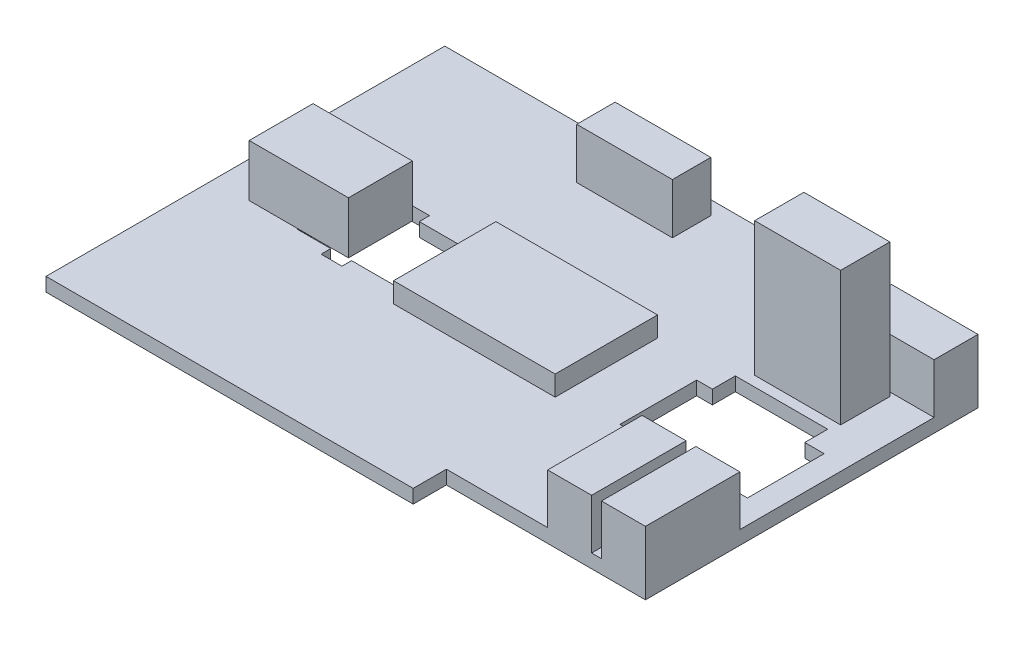
from build123d import *

# Parameters (mm, degrees)
BOSS_EXTRUDE1_DEPTH  = 1.72
CUT_EXTRUDE1_DEPTH   = 1.72
SKETCH6_W            = 5.52
SKETCH6_H            = 11.86
SKETCH6_W_2          = 10.85
SKETCH6_H_2          = 5.52
SWITCHES_DEPTH       = 6.28
SKETCH7_W            = 10.8
SKETCH7_H            = 6.18
SCROLLWHEEL_DEPTH    = 16.82
SKETCH8_W            = 20.3
SKETCH8_H            = 12.86
CHIP_DEPTH           = 2.52
SKETCH9_W            = 12.02
SKETCH9_H            = 4.82
USB_CONNECTION_DEPTH = 6.34
SKETCH10_W           = 12.47
SKETCH10_H           = 8.02
LASER_DEPTH          = 6.54


with BuildPart() as part:
    # Sketch1 → Boss-Extrude1 (new body)
    with BuildSketch(Plane(origin=(0, 0, 0), x_dir=(1, 0, 0), z_dir=(0, 1, 0))):
        Polygon((46.12, 45.94), (71.12, 45.94), (71.12, 4.17), (46.12, 4.17), (46.12, 0), (0, 0), (0, 50.09), (46.12, 50.09), align=None)
    extrude(amount=-BOSS_EXTRUDE1_DEPTH)

    # Sketch2 → Cut-Extrude1 (cut)
    with BuildSketch(Plane(origin=(0, 0, 0), x_dir=(1, 0, 0), z_dir=(0, 1, 0))):
        Polygon((65.72, 32.46), (54.12, 32.46), (54.12, 29.58), (52.14, 29.58), (52.14, 19.94), (54.12, 19.94), (54.12, 17.62), (65.72, 17.62), (65.72, 19.94), (68.16, 19.94), (68.16, 29.58), (65.72, 29.58), align=None)
        Polygon((17.483002282, 20.9), (17.483002282, 19.69), (14.863002282, 19.69), (14.863002282, 20.9), (10.663002282, 20.9), (10.663002282, 29.4), (14.863002282, 29.4), (14.863002282, 30.69), (17.483002282, 30.69), (17.483002282, 29.4), (44.54, 29.4), (44.54, 20.9), align=None)
    extrude(amount=-CUT_EXTRUDE1_DEPTH, mode=Mode.SUBTRACT)

    # Sketch6 → switches (add)
    with BuildSketch(Plane(origin=(0, 0, 0), x_dir=(1, 0, 0), z_dir=(0, 1, 0))):
        with Locations((68.36, 10.1)):
            Rectangle(SKETCH6_W, SKETCH6_H)
        with Locations((61.6, 10.1)):
            Rectangle(SKETCH6_W, SKETCH6_H)
        with Locations((65.695, 43.18)):
            Rectangle(SKETCH6_W_2, SKETCH6_H_2)
    extrude(amount=SWITCHES_DEPTH)

    # Sketch7 → scrollWheel (add)
    with BuildSketch(Plane(origin=(0, 0, 0), x_dir=(1, 0, 0), z_dir=(0, 1, 0))):
        with Locations((60.67, 36.83)):
            Rectangle(SKETCH7_W, SKETCH7_H)
    extrude(amount=SCROLLWHEEL_DEPTH)

    # Sketch8 → chip (add)
    with BuildSketch(Plane(origin=(0, 0, 0), x_dir=(1, 0, 0), z_dir=(0, 1, 0))):
        with Locations((34.97, 25.26)):
            Rectangle(SKETCH8_W, SKETCH8_H)
    extrude(amount=CHIP_DEPTH)

    # Sketch9 → USB Connection (add)
    with BuildSketch(Plane(origin=(0, 0, 0), x_dir=(1, 0, 0), z_dir=(0, 1, 0))):
        with Locations((29.14, 45.94)):
            Rectangle(SKETCH9_W, SKETCH9_H)
    extrude(amount=USB_CONNECTION_DEPTH)

    # Sketch10 → laser (add)
    with BuildSketch(Plane(origin=(0, 0, 0), x_dir=(1, 0, 0), z_dir=(0, 1, 0))):
        with Locations((10.755, 25.01)):
            Rectangle(SKETCH10_W, SKETCH10_H)
    extrude(amount=LASER_DEPTH)


solid = part.part
